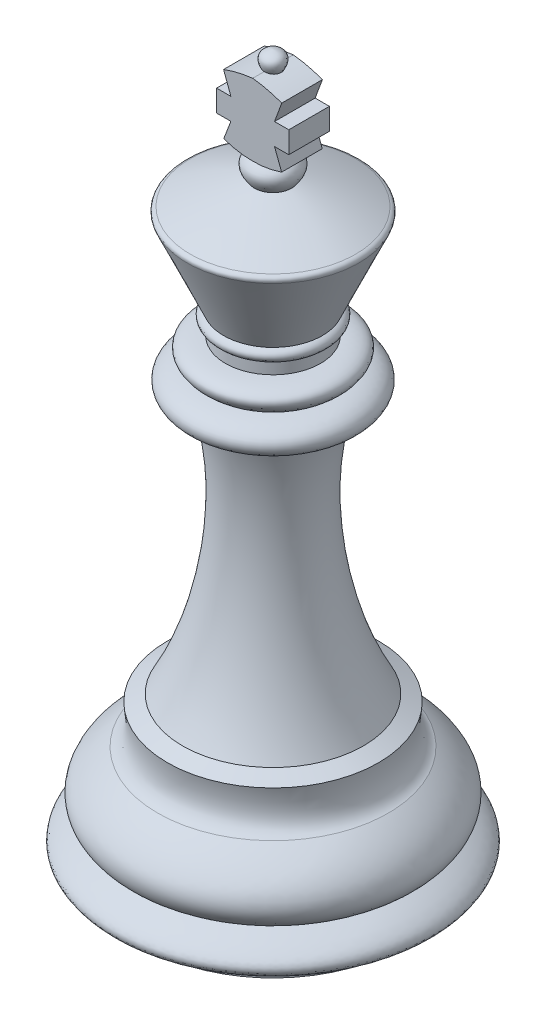
from build123d import *

# Parameters (mm, degrees)
BOSS_EXTRUDE1_DEPTH = 25
SCALE2_SCALE        = 0.5


with BuildPart() as part:
    # Sketch1 → Revolve1 (revolve)
    with BuildSketch(Plane.XY, mode=Mode.PRIVATE) as revolve1_sk:
        with BuildLine():
            Line((0, 0), (157.534566076, 0))
            Line((157.534566076, 0), (157.534566076, 9.848648506))
            add(Edge.make_bspline(
                [(157.534566076, 9.848648506), (170.691147361, 10.759205797), (179.87114019, 18.496002822)],
                knots=[0, 0, 0, 1, 1, 1], degree=2))
            add(Edge.make_bspline(
                [(179.87114019, 18.496002822), (197.389253044, 28.469185883), (213.045519488, 38.480052116), (164.243366154, 60.339349963)],
                knots=[0, 0, 0, 0, 1, 1, 1, 1], degree=3))
            add(Edge.make_bspline(
                [(164.243366154, 60.339349963), (192.275428556, 79.490747386), (185.402131901, 106.956056429), (141.828181852, 135.191976061)],
                knots=[0, 0, 0, 0, 1, 1, 1, 1], degree=3))
            add(Edge.make_bspline(
                [(141.828181852, 135.191976061), (122.588349336, 143.769748289), (129.839187911, 182.891609085)],
                knots=[0, 0, 0, 1, 1, 1], degree=2))
            Line((129.839187911, 182.891609085), (111.235524671, 191.512818879))
            add(Edge.make_bspline(
                [(111.235524671, 191.512818879), (59.189071108, 285.32730758), (43.190335037, 422.18893219), (73.704675046, 510.94143428)],
                knots=[0, 0, 0, 0, 1, 1, 1, 1], degree=3))
            Line((73.704675046, 510.94143428), (86.510405523, 510.94143428))
            add(Edge.make_bspline(
                [(86.510405523, 510.94143428), (107.201791664, 510.692559382), (120.002142397, 539.614520703), (76.212657991, 545.388958207)],
                knots=[0, 0, 0, 0, 1, 1, 1, 1], degree=3))
            add(Edge.make_bspline(
                [(76.212657991, 545.388958207), (95.444717478, 559.944574751), (90.562296866, 572.504825971), (58.512887719, 572.675301552)],
                knots=[0, 0, 0, 0, 1, 1, 1, 1], degree=3))
            Line((58.512887719, 572.675301552), (58.512887719, 586.892311661))
            add(Edge.make_bspline(
                [(58.512887719, 586.892311661), (68.877954513, 591.456407354), (69.67426492, 599.355096017), (60.73981448, 603.416209853)],
                knots=[0, 0, 0, 0, 1, 1, 1, 1], degree=3))
            Line((60.73981448, 603.416209853), (105.685214383, 703.290522926))
            add(Edge.make_bspline(
                [(105.685214383, 703.290522926), (107.180260536, 706.910941122), (105.782374551, 709.350866236), (101.836245926, 710.76204993)],
                knots=[0, 0, 0, 0, 1, 1, 1, 1], degree=3))
            add(Edge.make_bspline(
                [(22.81918761, 741.553797583), (64.193094091, 729.008017029), (101.836245926, 710.76204993)],
                knots=[0, 0, 0, 1, 1, 1], degree=2))
            add(Edge.make_bspline(
                [(22.81918761, 741.553797583), (34.270608042, 755.531147771), (30.646829273, 764.532738015), (16.98469883, 771.530414583)],
                knots=[0, 0, 0, 0, 1, 1, 1, 1], degree=3))
            Line((16.98469883, 771.530414583), (9.170548703, 771.530414583))
            Line((9.170548703, 771.530414583), (9.170548703, 857.068427711))
            add(Edge.make_bspline(
                [(0, 878.331808547), (20.404576067, 875.147202135), (9.170548703, 857.068427711)],
                knots=[0, 0, 0, 1, 1, 1], degree=2))
            Line((0, 878.331808547), (0, 0))
        make_face()
    revolve(revolve1_sk.sketch.rotate(Axis((0, 0, 0), (0, 1, 0)), 90), axis=Axis((0, 0, 0), (0, 1, 0)))

    # Sketch2 → Boss-Extrude1 (add, symmetric)
    with BuildSketch(Plane.XY):
        with BuildLine():
            Line((-35.807636582, 851.285546322), (-26.849503905, 827.139142514))
            Line((-26.849503905, 827.139142514), (-44.400594396, 827.139142514))
            Line((-44.400594396, 827.139142514), (-44.400594396, 800.519262571))
            Line((-44.400594396, 800.519262571), (-26.849503905, 800.519262571))
            Line((-26.849503905, 800.519262571), (-35.625049151, 777.597104674))
            add(Edge.make_bspline(
                [(-35.625049151, 777.597104674), (-17.370634382, 771.286917559), (0, 771.530414583)],
                knots=[0, 0, 0, 1, 1, 1], degree=2))
            add(Edge.make_bspline(
                [(35.625049151, 777.597104674), (17.370634382, 771.286917559), (0, 771.530414583)],
                knots=[0, 0, 0, 1, 1, 1], degree=2))
            Line((35.625049151, 777.597104674), (26.849503905, 800.519262571))
            Line((26.849503905, 800.519262571), (44.400594396, 800.519262571))
            Line((44.400594396, 800.519262571), (44.400594396, 827.139142514))
            Line((44.400594396, 827.139142514), (26.849503905, 827.139142514))
            Line((26.849503905, 827.139142514), (35.807636582, 851.285546322))
            add(Edge.make_bspline(
                [(35.807636582, 851.285546322), (18.233654929, 857.805360227), (0, 859.787588823)],
                knots=[0, 0, 0, 1, 1, 1], degree=2))
            add(Edge.make_bspline(
                [(-35.807636582, 851.285546322), (-18.233654929, 857.805360227), (0, 859.787588823)],
                knots=[0, 0, 0, 1, 1, 1], degree=2))
        make_face()
    extrude(amount=BOSS_EXTRUDE1_DEPTH, both=True)


with BuildPart() as part_1:
    # Scale2: scaled about (0, 0, 0)
    add(part.part.scale(SCALE2_SCALE))


solid = part_1.part
